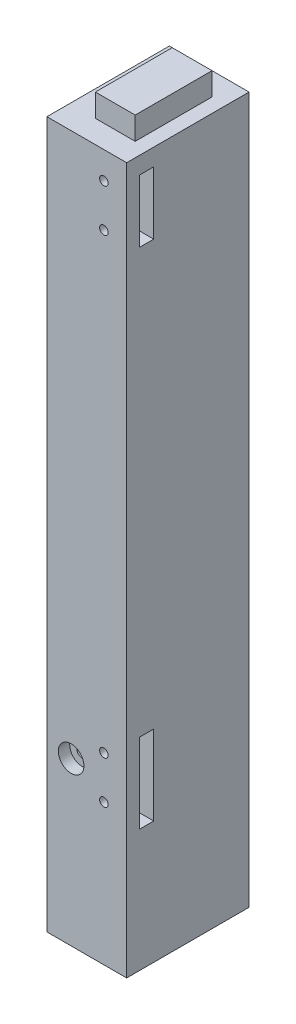
from build123d import *

# Parameters (mm, degrees)
SKETCH1_W           = 88.9
SKETCH1_H           = 787.4
BOSS_EXTRUDE1_DEPTH = 136.525
SKETCH2_W           = 44.45
SKETCH2_H           = 85.725
BOSS_EXTRUDE2_DEPTH = 25.4
SKETCH4_W           = 15.875
SKETCH4_H           = 88.9
SKETCH4_H_2         = 69.85
CUT_EXTRUDE1_DEPTH  = 50.8
SKETCH5_W           = 25.4
SKETCH5_H           = 82.55
CUT_EXTRUDE2_DEPTH  = 50.8
SKETCH6_R           = 14.2875
CUT_EXTRUDE3_DEPTH  = 12.7
SKETCH7_R           = 6.35
CUT_EXTRUDE4_DEPTH  = 440.264434168
SKETCH6_4_R         = 4.7625
CUT_EXTRUDE5_DEPTH  = 44.45


with BuildPart() as part:
    # Sketch1 → Boss-Extrude1 (new body)
    with BuildSketch(Plane.XY):
        Rectangle(SKETCH1_W, SKETCH1_H)
    extrude(amount=BOSS_EXTRUDE1_DEPTH)

    # Sketch2 → Boss-Extrude2 (add)
    with BuildSketch(Plane(origin=(0, 393.7, 0), x_dir=(1, 0, 0), z_dir=(0, 1, 0))):
        with Locations((6.35, -68.2625)):
            Rectangle(SKETCH2_W, SKETCH2_H)
    extrude(amount=BOSS_EXTRUDE2_DEPTH)

    # Sketch4 → Cut-Extrude1 (cut)
    with BuildSketch(Plane(origin=(44.45, 0, 0), x_dir=(0, 0, -1), z_dir=(1, 0, 0))):
        with Locations((-114.3, -212.725)):
            Rectangle(SKETCH4_W, SKETCH4_H)
        with Locations((-114.3, 339.725)):
            Rectangle(SKETCH4_W, SKETCH4_H_2)
    extrude(amount=-CUT_EXTRUDE1_DEPTH, mode=Mode.SUBTRACT)

    # Sketch5 → Cut-Extrude2 (cut)
    with BuildSketch(Plane(origin=(0, 0, 0), x_dir=(-1, 0, 0), z_dir=(0, 0, -1))):
        with Locations((17.4625, -212.725)):
            Rectangle(SKETCH5_W, SKETCH5_H)
    extrude(amount=-CUT_EXTRUDE2_DEPTH, mode=Mode.SUBTRACT)

    # Sketch6 → Cut-Extrude3 (cut)
    with BuildSketch(Plane.XY.offset(136.525)):
        with Locations((-17.4625, -212.725)):
            Circle(SKETCH6_R)
    extrude(amount=-CUT_EXTRUDE3_DEPTH, mode=Mode.SUBTRACT)

    # Sketch7 → Cut-Extrude4 (cut, through all)
    with BuildSketch(Plane.XY.offset(123.825)):
        with Locations((-17.4625, -212.725)):
            Circle(SKETCH7_R)
    extrude(amount=-CUT_EXTRUDE4_DEPTH, mode=Mode.SUBTRACT)

    # Sketch6<4> → Cut-Extrude5 (cut)
    with BuildSketch(Plane.XY.offset(136.525)):
        with Locations((19.05, 363.5375)):
            Circle(SKETCH6_4_R)
        with Locations((19.05, 315.9125)):
            Circle(SKETCH6_4_R)
        with Locations((19.05, -236.5375)):
            Circle(SKETCH6_4_R)
        with Locations((19.05, -188.9125)):
            Circle(SKETCH6_4_R)
    extrude(amount=-CUT_EXTRUDE5_DEPTH, mode=Mode.SUBTRACT)


solid = part.part
